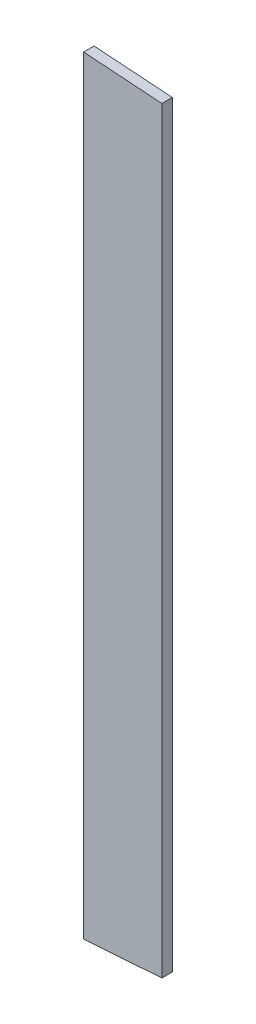
from build123d import *

# Parameters (mm, degrees)
BOSS_EXTRUDE1_DEPTH = 2


with BuildPart() as part:
    # Sketch1 → Boss-Extrude1 (new body)
    with BuildSketch(Plane.XY.offset(3895.249999999)):
        Polygon((-49.769678516, 346.108282384), (-64.769678516, 345.059380205), (-64.769678516, 492.415801833), (-49.769678516, 491.366899654), align=None)
    extrude(amount=BOSS_EXTRUDE1_DEPTH)


solid = part.part
